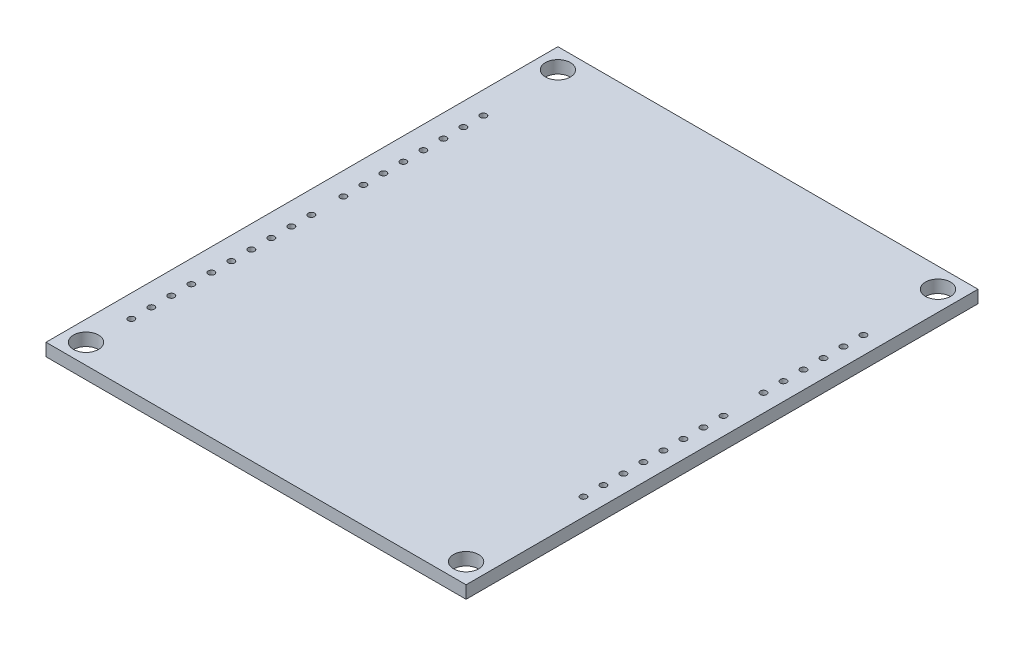
from build123d import *

# Parameters (mm, degrees)
SKETCH1_W           = 53.34
SKETCH1_H           = 65
SKETCH1_R           = 1.5875
BOSS_EXTRUDE1_DEPTH = 1.6
SKETCH2_R           = 0.4
CUT_EXTRUDE1_DEPTH  = 1.65
SKETCH3_R           = 0.4
CUT_EXTRUDE2_DEPTH  = 1.65
LPATTERN1_COUNT     = 15
LPATTERN1_PITCH     = 2.54
SKETCH4_R           = 0.4
CUT_EXTRUDE3_DEPTH  = 1.65
LPATTERN2_COUNT     = 10
LPATTERN2_PITCH     = 2.54
LPATTERN3_COUNT     = 9
LPATTERN3_PITCH     = 2.54


with BuildPart() as part:
    # Sketch1 → Boss-Extrude1 (new body)
    with BuildSketch(Plane(origin=(0, 0, 0), x_dir=(1, 0, 0), z_dir=(0, 1, 0))):
        with Locations((-26.975572741, 43.308375706)):
            Rectangle(SKETCH1_W, SKETCH1_H)
        with Locations(Location((-51.105572741, 73.268375706, 0), (0, 0, 270))):
            Circle(SKETCH1_R, mode=Mode.SUBTRACT)
        with Locations(Location((-2.845572741, 73.268375706, 0), (0, 0, 270))):
            Circle(SKETCH1_R, mode=Mode.SUBTRACT)
        with Locations(Location((-2.845572741, 13.348375706, 0), (0, 0, 270))):
            Circle(SKETCH1_R, mode=Mode.SUBTRACT)
        with Locations(Location((-51.105572741, 13.348375706, 0), (0, 0, 270))):
            Circle(SKETCH1_R, mode=Mode.SUBTRACT)
    extrude(amount=-BOSS_EXTRUDE1_DEPTH)

    # Sketch2 → Cut-Extrude1 (cut)
    with BuildSketch(Plane(origin=(0, 0, 0), x_dir=(1, 0, 0), z_dir=(0, 1, 0))):
        with Locations(Location((-2.54, 27.94, 0), (0, 0, 270))):
            Circle(SKETCH2_R)
    cut_extrude1 = extrude(amount=-CUT_EXTRUDE1_DEPTH, mode=Mode.SUBTRACT)

    # Sketch3 → Cut-Extrude2 (cut)
    with BuildSketch(Plane(origin=(0, 0, 0), x_dir=(1, 0, 0), z_dir=(0, 1, 0))):
        with Locations(Location((-50.8, 18.796, 0), (0, 0, 270))):
            Circle(SKETCH3_R)
    cut_extrude2 = extrude(amount=-CUT_EXTRUDE2_DEPTH, mode=Mode.SUBTRACT)

    # LPattern1: Cut-Extrude1 ×15, 1 skipped
    with Locations(*[(0, 0, -i * LPATTERN1_PITCH) for i in range(1, LPATTERN1_COUNT) if i not in (8,)]):
        add(cut_extrude1, mode=Mode.SUBTRACT)

    # Sketch4 → Cut-Extrude3 (cut)
    with BuildSketch(Plane(origin=(0, 0, 0), x_dir=(1, 0, 0), z_dir=(0, 1, 0))):
        with Locations(Location((-50.8, 45.72, 0), (0, 0, 270))):
            Circle(SKETCH4_R)
    cut_extrude3 = extrude(amount=-CUT_EXTRUDE3_DEPTH, mode=Mode.SUBTRACT)

    # LPattern2: Cut-Extrude2 ×10
    with Locations(*[(0, 0, -i * LPATTERN2_PITCH) for i in range(1, LPATTERN2_COUNT)]):
        add(cut_extrude2, mode=Mode.SUBTRACT)

    # LPattern3: Cut-Extrude3 ×9, 1 skipped
    with Locations(*[(0, 0, -i * LPATTERN3_PITCH) for i in range(1, LPATTERN3_COUNT) if i not in (8,)]):
        add(cut_extrude3, mode=Mode.SUBTRACT)


solid = part.part
